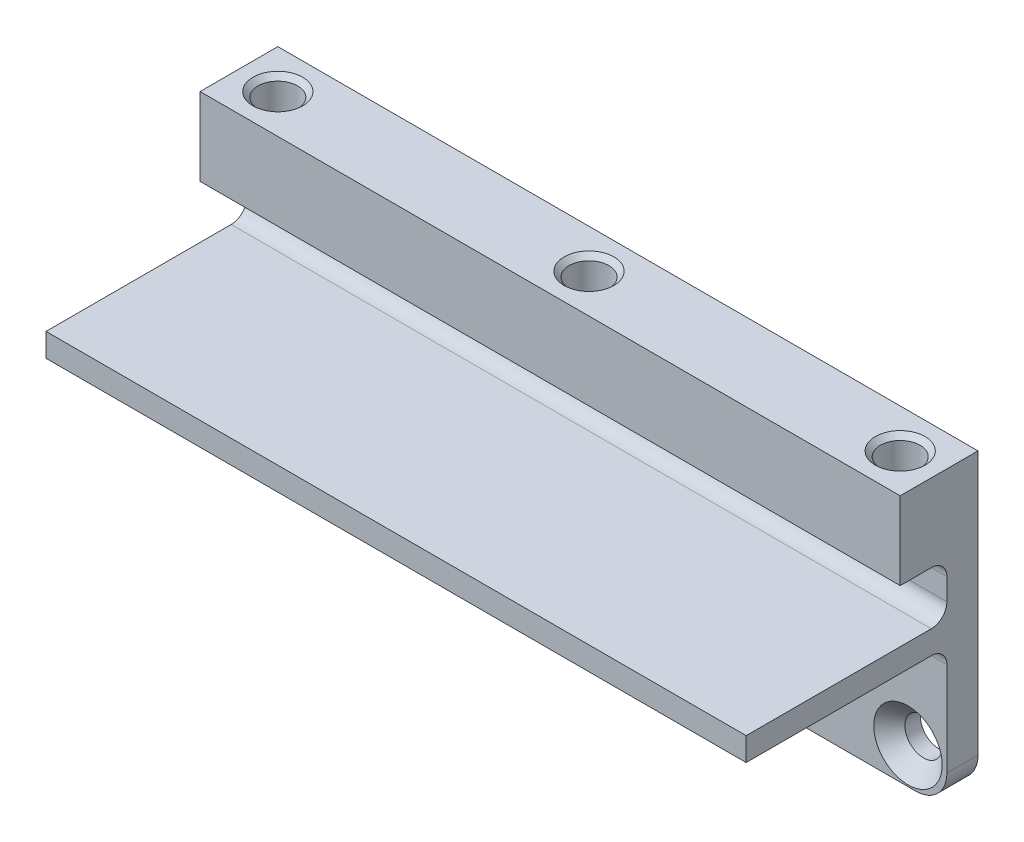
from build123d import *

# Parameters (mm, degrees)
BOSS_EXTRUDE1_DEPTH                             = 22.5
FILLET1_R                                       = 1
CSK_FOR_M2_FLAT_HEAD_MACHINE_SCREW1_D           = 2.4
CSK_FOR_M2_FLAT_HEAD_MACHINE_SCREW1_DEPTH       = 6.45
CSK_FOR_M2_FLAT_HEAD_MACHINE_SCREW1_CSINK_D     = 4.4
CSK_FOR_M2_FLAT_HEAD_MACHINE_SCREW1_CSINK_ANGLE = 90
CSK_FOR_M2_FLAT_HEAD_MACHINE_SCREW1_TIP         = 0.721032743
FILLET2_R                                       = 2
TAPPED_HOLE_FOR_M2_5X0_45_HELICOIL1_D           = 2.55
TAPPED_HOLE_FOR_M2_5X0_45_HELICOIL1_DEPTH       = 4
TAPPED_HOLE_FOR_M2_5X0_45_HELICOIL1_CSINK_D     = 3.195
TAPPED_HOLE_FOR_M2_5X0_45_HELICOIL1_CSINK_ANGLE = 90
TAPPED_HOLE_FOR_M2_5X0_45_HELICOIL1_TIP         = 0.766097289


with BuildPart() as part:
    # Sketch1 → Boss-Extrude1 (new, symmetric)
    with BuildSketch(Plane(origin=(0, 0, 0), x_dir=(0, 0, -1), z_dir=(1, 0, 0))):
        Polygon((0, 0), (0, 18.94), (-5, 18.94), (-5, 13.94), (-2, 13.94), (-2, 10.54), (-14.9, 10.54), (-14.9, 9.04), (-2, 9.04), (-2, 0), align=None)
    extrude(amount=BOSS_EXTRUDE1_DEPTH, both=True)

    # Fillet1
    fillet1_edges = [part.edges().sort_by_distance(p)[0] for p in [
        (0, 9.04, 2),
        (0, 10.54, 2),
        (0, 13.94, 2),
    ]]
    fillet(fillet1_edges, radius=FILLET1_R)

    # CSK for M2 Flat Head Machine Screw1
    with Locations(Plane.XY.offset(2)):
        with Locations((20, 2.3), (-20, 2.3), (0, 2.3)):
            CounterSinkHole(CSK_FOR_M2_FLAT_HEAD_MACHINE_SCREW1_D / 2, CSK_FOR_M2_FLAT_HEAD_MACHINE_SCREW1_CSINK_D / 2, depth=CSK_FOR_M2_FLAT_HEAD_MACHINE_SCREW1_DEPTH, counter_sink_angle=CSK_FOR_M2_FLAT_HEAD_MACHINE_SCREW1_CSINK_ANGLE)
            with Locations((0, 0, -(CSK_FOR_M2_FLAT_HEAD_MACHINE_SCREW1_DEPTH + CSK_FOR_M2_FLAT_HEAD_MACHINE_SCREW1_TIP / 2))):  # 118° drill point
                Cone(0, CSK_FOR_M2_FLAT_HEAD_MACHINE_SCREW1_D / 2, CSK_FOR_M2_FLAT_HEAD_MACHINE_SCREW1_TIP, mode=Mode.SUBTRACT)

    # Fillet2
    fillet2_edges = [part.edges().sort_by_distance(p)[0] for p in [
        (-22.5, 0, 1),
        (22.5, 0, 1),
    ]]
    fillet(fillet2_edges, radius=FILLET2_R)

    # Tapped Hole for M2.5x0.45 Helicoil1
    with Locations(Plane(origin=(0, 18.94, 0), x_dir=(1, 0, 0), z_dir=(0, 1, 0))):
        with Locations((20, -2.5), (-20, -2.5), (0, -2.5)):
            CounterSinkHole(TAPPED_HOLE_FOR_M2_5X0_45_HELICOIL1_D / 2, TAPPED_HOLE_FOR_M2_5X0_45_HELICOIL1_CSINK_D / 2, depth=TAPPED_HOLE_FOR_M2_5X0_45_HELICOIL1_DEPTH, counter_sink_angle=TAPPED_HOLE_FOR_M2_5X0_45_HELICOIL1_CSINK_ANGLE)
            with Locations((0, 0, -(TAPPED_HOLE_FOR_M2_5X0_45_HELICOIL1_DEPTH + TAPPED_HOLE_FOR_M2_5X0_45_HELICOIL1_TIP / 2))):  # 118° drill point
                Cone(0, TAPPED_HOLE_FOR_M2_5X0_45_HELICOIL1_D / 2, TAPPED_HOLE_FOR_M2_5X0_45_HELICOIL1_TIP, mode=Mode.SUBTRACT)


solid = part.part
